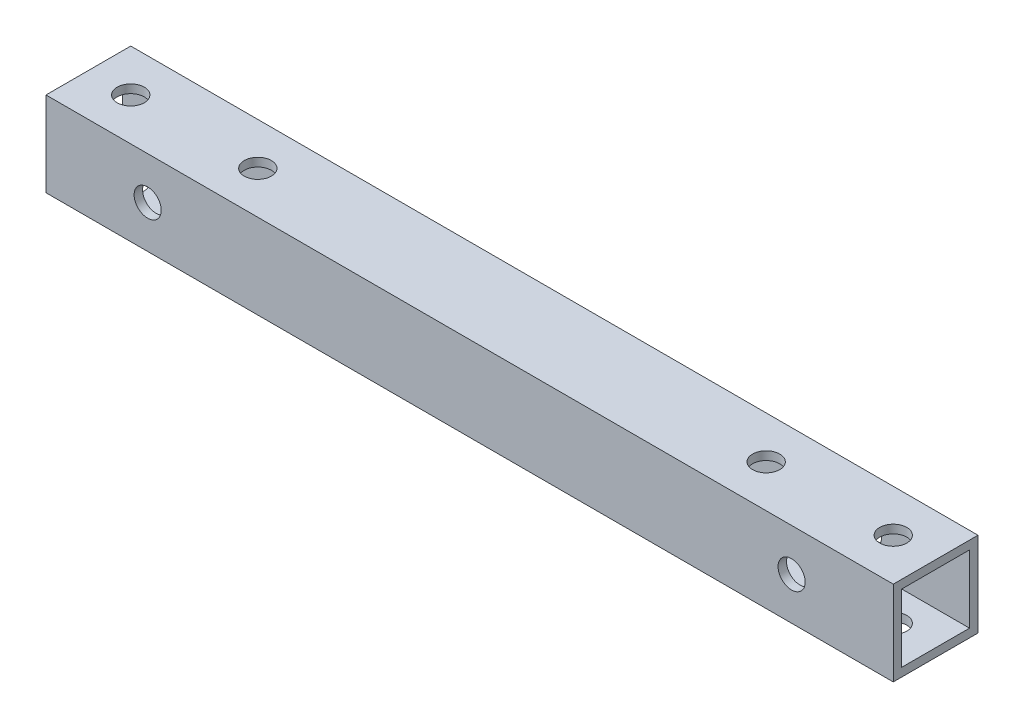
from build123d import *

# Parameters (mm, degrees)
SKETCH_1_W          = 10
SKETCH_1_H          = 10
EXTRUDE_1_DEPTH     = 50
SKETCH_2_W          = 8
SKETCH_2_H          = 8
CUT_EXTRUDE_1_DEPTH = 101.249688279
SKETCH_3_R          = 1.6
CUT_EXTRUDE_2_DEPTH = 52.23475383
SKETCH_4_R          = 1.6
CUT_EXTRUDE_3_DEPTH = 52.23475383


with BuildPart() as part:
    # ｽｹｯﾁ1 → ﾎﾞｽ - 押し出し1 (new, symmetric)
    with BuildSketch(Plane(origin=(0, 0, 0), x_dir=(0, 0, -1), z_dir=(1, 0, 0))):
        Rectangle(SKETCH_1_W, SKETCH_1_H)
    extrude(amount=EXTRUDE_1_DEPTH, both=True)

    # ｽｹｯﾁ2 → ｶｯﾄ - 押し出し1 (cut, through all)
    with BuildSketch(Plane(origin=(50, 0, 0), x_dir=(0, 0, -1), z_dir=(1, 0, 0))):
        Rectangle(SKETCH_2_W, SKETCH_2_H)
    extrude(amount=-CUT_EXTRUDE_1_DEPTH, mode=Mode.SUBTRACT)

    # ｽｹｯﾁ3 → ｶｯﾄ - 押し出し2 (cut, through all)
    with BuildSketch(Plane(origin=(0, 5, 0), x_dir=(1, 0, 0), z_dir=(0, 1, 0))):
        with Locations(Location((-45, 0, 0), (0, 0, 270))):
            Circle(SKETCH_3_R)
        with Locations(Location((-30, 0, 0), (0, 0, 270))):
            Circle(SKETCH_3_R)
        with Locations(Location((30, 0, 0), (0, 0, 270))):
            Circle(SKETCH_3_R)
        with Locations(Location((45, 0, 0), (0, 0, 270))):
            Circle(SKETCH_3_R)
    extrude(amount=-CUT_EXTRUDE_2_DEPTH, mode=Mode.SUBTRACT)

    # ｽｹｯﾁ4 → ｶｯﾄ - 押し出し3 (cut, through all)
    with BuildSketch(Plane.XY.offset(5)):
        with Locations((-38, 0)):
            Circle(SKETCH_4_R)
        with Locations((38, 0)):
            Circle(SKETCH_4_R)
    extrude(amount=-CUT_EXTRUDE_3_DEPTH, mode=Mode.SUBTRACT)


solid = part.part
